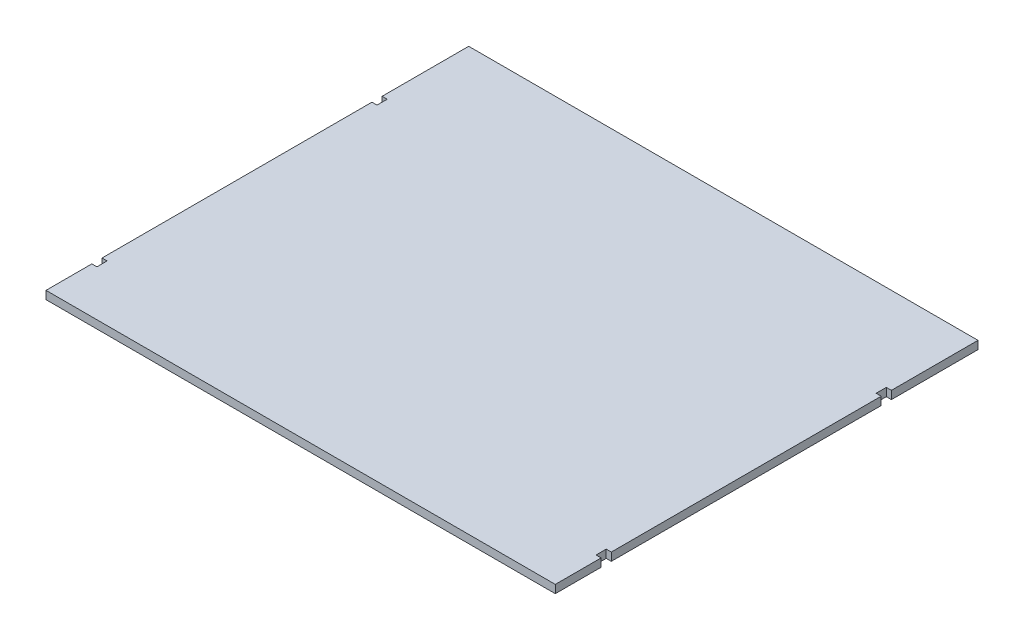
from build123d import *

# Parameters (mm, degrees)
BOSS_EXTRUDE1_DEPTH = 1.5875


with BuildPart() as part:
    # Sketch1 → Boss-Extrude1 (new body)
    with BuildSketch(Plane(origin=(0, 0, 0), x_dir=(1, 0, 0), z_dir=(0, 1, 0))):
        Polygon((0, 9), (1, 9), (1, 11), (0, 11), (0, 64), (1, 64), (1, 66), (0, 66), (0, 83), (100, 83), (100, 66), (99, 66), (99, 64), (100, 64), (100, 11), (99, 11), (99, 9), (100, 9), (100, 0), (0, 0), align=None)
    extrude(amount=BOSS_EXTRUDE1_DEPTH)


solid = part.part
